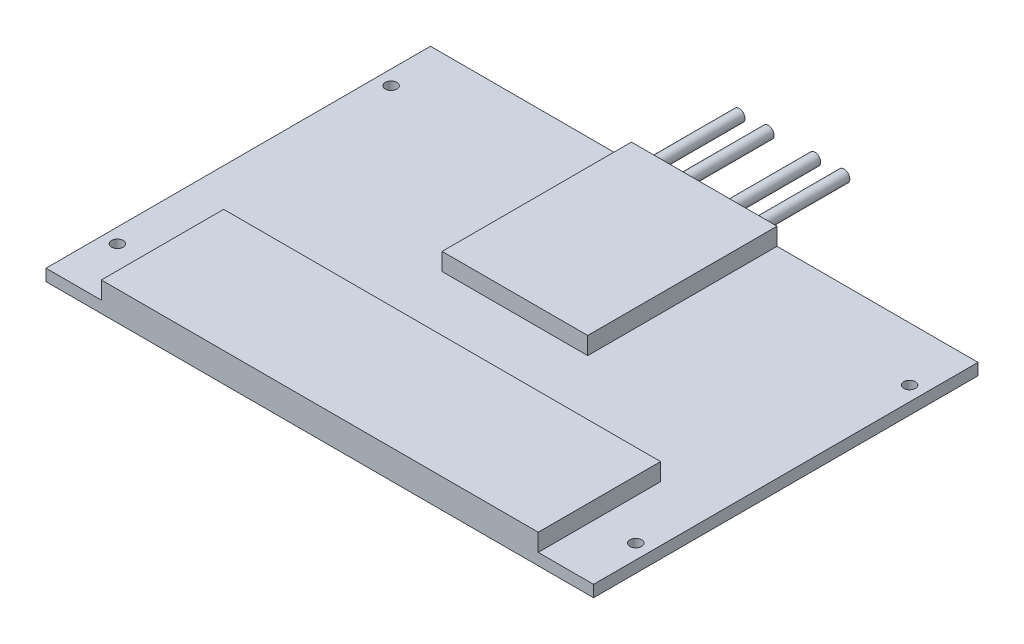
from build123d import *

# Parameters (mm, degrees)
SKETCH_1_W          = 188
SKETCH_1_H          = 132
EXTRUDE_1_DEPTH     = 4
SKETCH_2_W          = 50
SKETCH_2_H          = 65
SKETCH_2_W_2        = 150
SKETCH_2_H_2        = 42
EXTRUDE_2_DEPTH     = 6
SKETCH_3_R          = 2
EXTRUDE_3_DEPTH     = 30
SKETCH_4_R          = 2
CUT_EXTRUDE_1_DEPTH = 10


with BuildPart() as part:
    # 草图1 → 凸台-拉伸1 (new body)
    with BuildSketch(Plane(origin=(0, 0, 0), x_dir=(1, 0, 0), z_dir=(0, 1, 0))):
        with Locations((0, 66)):
            Rectangle(SKETCH_1_W, SKETCH_1_H)
    extrude(amount=EXTRUDE_1_DEPTH)

    # 草图2 → 凸台-拉伸2 (add)
    with BuildSketch(Plane(origin=(0, 4, 0), x_dir=(1, 0, 0), z_dir=(0, 1, 0))):
        with Locations((0, 99.5)):
            Rectangle(SKETCH_2_W, SKETCH_2_H)
        with Locations((0, 21)):
            Rectangle(SKETCH_2_W_2, SKETCH_2_H_2)
    extrude(amount=EXTRUDE_2_DEPTH)

    # 草图3 → 凸台-拉伸3 (add)
    with BuildSketch(Plane(origin=(0, 0, -132), x_dir=(-1, 0, 0), z_dir=(0, 0, -1))):
        with Locations(Location((-18, 6.5, 0), (0, 0, 180))):
            Circle(SKETCH_3_R)
        with Locations(Location((-8, 6.5, 0), (0, 0, 180))):
            Circle(SKETCH_3_R)
        with Locations(Location((8, 6.5, 0), (0, 0, 180))):
            Circle(SKETCH_3_R)
        with Locations(Location((18, 6.5, 0), (0, 0, 180))):
            Circle(SKETCH_3_R)
    extrude(amount=EXTRUDE_3_DEPTH)

    # 草图4 → 切除-拉伸1 (cut)
    with BuildSketch(Plane(origin=(0, 4, 0), x_dir=(1, 0, 0), z_dir=(0, 1, 0))):
        with Locations(Location((89, 113.5, 0), (0, 0, 270))):
            Circle(SKETCH_4_R)
        with Locations(Location((89, 19.5, 0), (0, 0, 270))):
            Circle(SKETCH_4_R)
        with Locations(Location((-89, 19.5, 0), (0, 0, 270))):
            Circle(SKETCH_4_R)
        with Locations(Location((-89, 113.5, 0), (0, 0, 270))):
            Circle(SKETCH_4_R)
    extrude(amount=-CUT_EXTRUDE_1_DEPTH, mode=Mode.SUBTRACT)


solid = part.part
